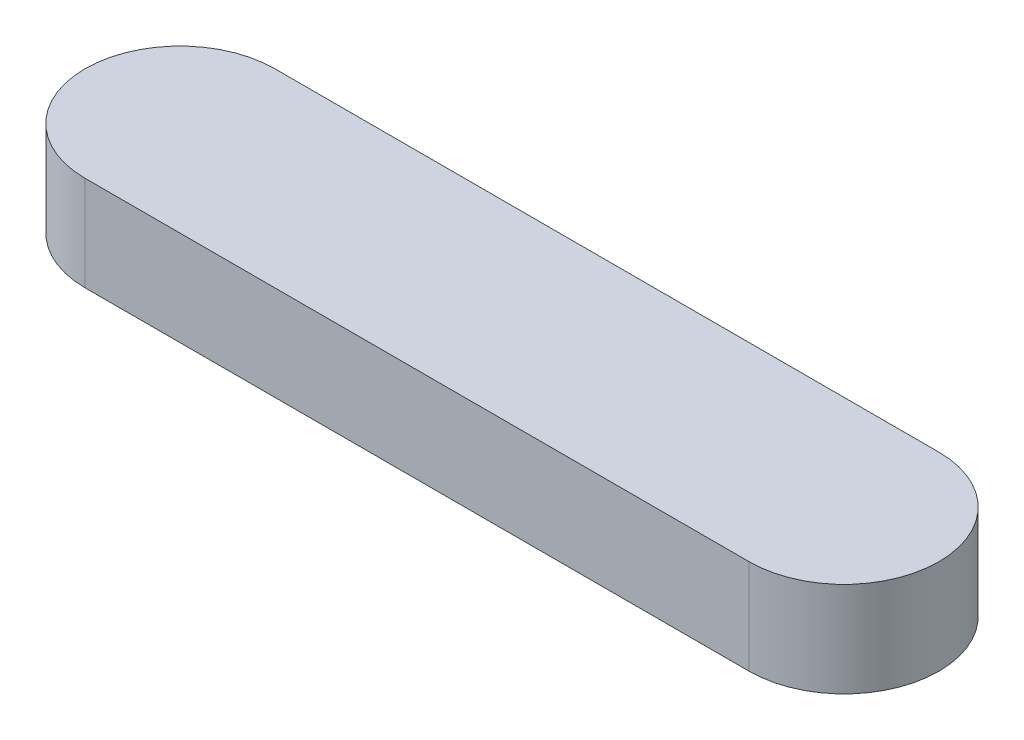
from build123d import *

# Parameters (mm, degrees)
BOSS_EXTRUDE1_DEPTH = 25.4


with BuildPart() as part:
    # Sketch1 → Boss-Extrude1 (new body)
    with BuildSketch(Plane(origin=(0, 0, 0), x_dir=(1, 0, 0), z_dir=(0, 1, 0))):
        with BuildLine():
            Line((-114.3, 25.4), (63.5, 25.4))
            ThreePointArc((63.5, 25.4), (88.9, 0), (63.5, -25.4))
            Line((63.5, -25.4), (-114.3, -25.4))
            ThreePointArc((-114.3, -25.4), (-139.7, 0), (-114.3, 25.4))
        make_face()
    extrude(amount=BOSS_EXTRUDE1_DEPTH)


solid = part.part
